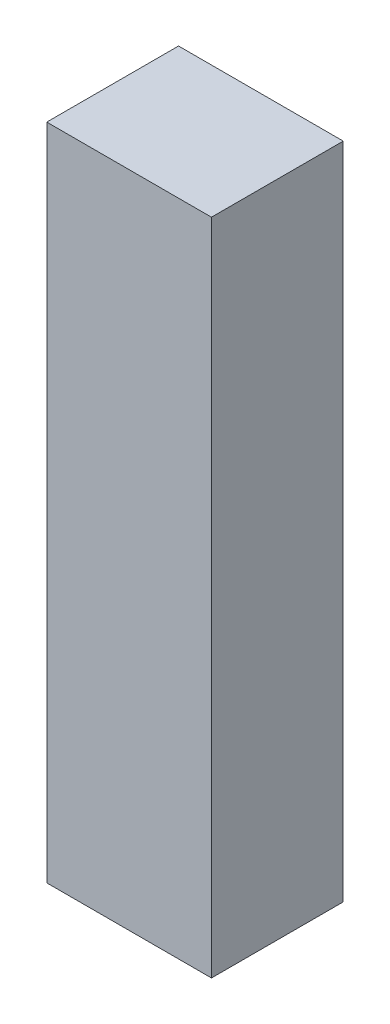
from build123d import *

# Parameters (mm, degrees)
TOPPING_ARKA_DUVAR_PANO_SURUCU_6_1_START = -736
SKETCH1_W                                = 50
SKETCH1_H                                = 200
TOPPING_ARKA_DUVAR_PANO_SURUCU_6_1_DEPTH = 40


with BuildPart() as part:
    # Sketch1 → TOPPING_arka_duvar_pano_surucu_6_1 (new body)
    with BuildSketch(Plane.XY.offset(TOPPING_ARKA_DUVAR_PANO_SURUCU_6_1_START)):
        with Locations((545, 430)):
            Rectangle(SKETCH1_W, SKETCH1_H)
    extrude(amount=-TOPPING_ARKA_DUVAR_PANO_SURUCU_6_1_DEPTH)


solid = part.part
